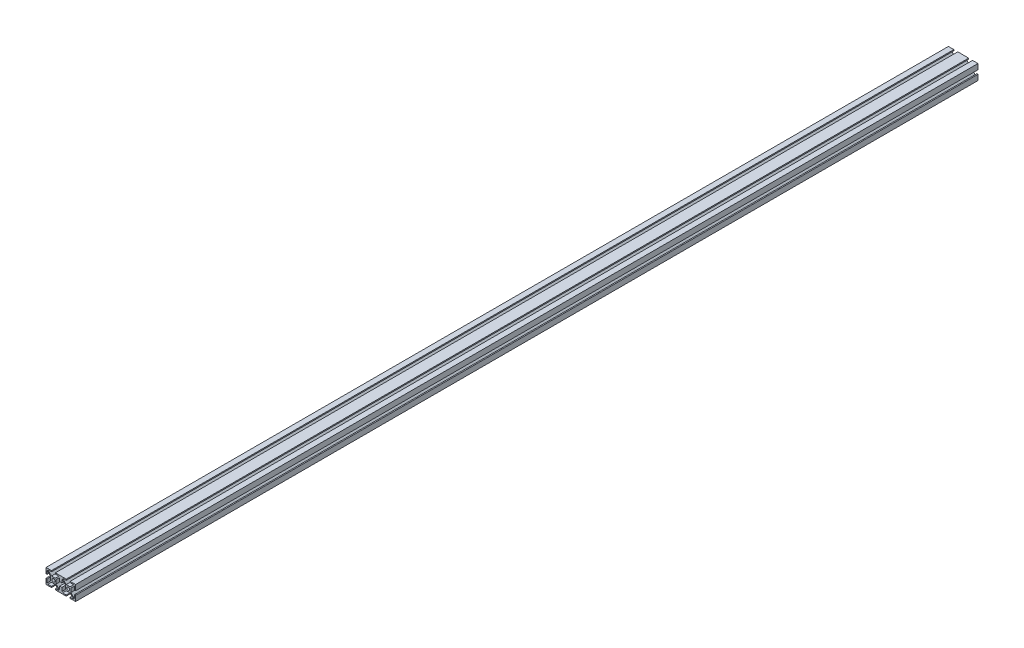
from build123d import *

# Parameters (mm, degrees)
SKETCH1_R           = 2.095
BOSS_EXTRUDE1_DEPTH = 1220
LPATTERN1_COUNT     = 2
LPATTERN1_PITCH     = 20


with BuildPart() as part:
    # Sketch1 → Boss-Extrude1 (new body)
    with BuildSketch(Plane.XY):
        Polygon((6.345, 12.594339828), (1.5, 17.439339828), (1.5, 12.63), (0, 12.63), (0, 20), (7.37, 20), (7.37, 18.5), (2.560660172, 18.5), (7.405660172, 13.655), (12.594339828, 13.655), (17.439339828, 18.5), (12.63, 18.5), (12.63, 20), (20, 20), (20, 12.63), (18.5, 12.63), (18.5, 17.439339828), (13.655, 12.594339828), (13.655, 7.405660172), (18.5, 2.560660172), (18.5, 7.37), (20, 7.37), (20, 0), (12.63, 0), (12.63, 1.5), (17.439339828, 1.5), (12.594339828, 6.345), (7.405660172, 6.345), (2.560660172, 1.5), (7.37, 1.5), (7.37, 0), (0, 0), (0, 7.37), (1.5, 7.37), (1.5, 2.560660172), (6.345, 7.405660172), align=None)
        with Locations((10, 10)):
            Circle(SKETCH1_R, mode=Mode.SUBTRACT)
    boss_extrude1 = extrude(amount=BOSS_EXTRUDE1_DEPTH)

    # LPattern1: Boss-Extrude1 ×2
    with Locations(*[(i * LPATTERN1_PITCH, 0, 0) for i in range(1, LPATTERN1_COUNT)]):
        add(boss_extrude1)


solid = part.part
